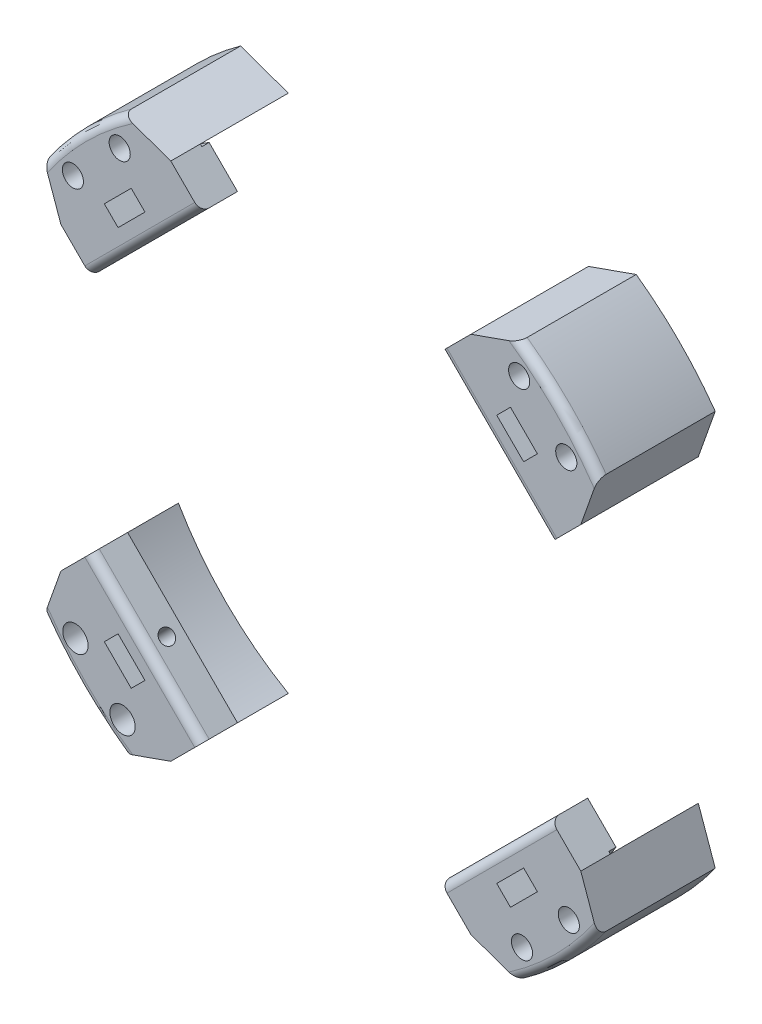
from build123d import *

# Parameters (mm, degrees)
SKETCH5_R             = 1.7
BOSS_EXTRUDE3_DEPTH   = 20.8
BOSS_EXTRUDE3_2_DEPTH = 20.8
BOSS_EXTRUDE3_3_DEPTH = 20.8
BOSS_EXTRUDE3_4_DEPTH = 20.8
SKETCH6_R             = 2.5
CUT_EXTRUDE3_DEPTH    = 15.8
SKETCH8_R             = 2.5
BOSS_EXTRUDE4_DEPTH   = 7
CUT_EXTRUDE4_DEPTH    = 7
SKETCH10_R            = 1.7
CUT_EXTRUDE5_DEPTH    = 16
BOSS_EXTRUDE5_DEPTH   = 1.7
SKETCH14_R            = 1.7
CUT_EXTRUDE6_DEPTH    = 15.361115509
SKETCH15_R            = 1.7
CUT_EXTRUDE7_DEPTH    = 15.361115509
SKETCH16_R            = 1.7
CUT_EXTRUDE8_DEPTH    = 15.361115509
FILLET5_R             = 2
FILLET6_R             = 2
FILLET7_R             = 2
FILLET8_R             = 2
FILLET9_R             = 2
FILLET10_R            = 2
FILLET11_R            = 2
FILLET12_R            = 2
SKETCH17_R            = 3
CUT_EXTRUDE9_DEPTH    = 22.8


with BuildPart() as part:
    # Sketch5 → Boss-Extrude3 (new body)
    with BuildSketch(Plane.XY):
        with BuildLine():
            Line((-45.996091263, 46.802906206), (-41.991324477, 35.493901083))
            ThreePointArc((-41.991324477, 35.493901083), (-30.704574922, 50.204588007), (-15.993885056, 61.491333728))
            Line((-15.993885056, 61.491333728), (-27.302906206, 65.496091263))
            ThreePointArc((-27.302906206, 65.496091263), (-37.422095886, 56.922095886), (-45.996091263, 46.802906206))
        make_face()
        with Locations(Location((-39.158598122, 46.910337234, 0), (0, 0, 90))):
            Circle(SKETCH5_R, mode=Mode.SUBTRACT)
        with Locations(Location((-28.083608747, 58.055274509, 0), (0, 0, 90))):
            Circle(SKETCH5_R, mode=Mode.SUBTRACT)
    extrude(amount=BOSS_EXTRUDE3_DEPTH)


with BuildPart() as body_2:
    # Sketch5 → Boss-Extrude3 2 (new body)
    with BuildSketch(Plane.XY):
        with BuildLine():
            Line((66.302906206, 65.496091263), (54.993901083, 61.491324477))
            ThreePointArc((54.993901083, 61.491324477), (69.704588007, 50.204574922), (80.991333728, 35.493885056))
            Line((80.991333728, 35.493885056), (84.996091262, 46.802906206))
            ThreePointArc((84.996091262, 46.802906206), (76.422095886, 56.922095886), (66.302906206, 65.496091263))
        make_face()
        with Locations(Location((66.410337234, 58.658598122, 0), (0, 0, 90))):
            Circle(SKETCH5_R, mode=Mode.SUBTRACT)
        with Locations(Location((77.555274509, 47.583608747, 0), (0, 0, 90))):
            Circle(SKETCH5_R, mode=Mode.SUBTRACT)
    extrude(amount=BOSS_EXTRUDE3_2_DEPTH)


with BuildPart() as body_3:
    # Sketch5 → Boss-Extrude3 3 (new body)
    with BuildSketch(Plane.XY):
        with BuildLine():
            Line((84.996091263, -46.802906206), (80.991324477, -35.493901083))
            ThreePointArc((80.991324477, -35.493901083), (69.704574922, -50.204588007), (54.993885056, -61.491333728))
            Line((54.993885056, -61.491333728), (66.302906206, -65.496091262))
            ThreePointArc((66.302906206, -65.496091262), (76.422095886, -56.922095885), (84.996091263, -46.802906206))
        make_face()
        with Locations(Location((78.158598122, -46.910337234, 0), (0, 0, 90))):
            Circle(SKETCH5_R, mode=Mode.SUBTRACT)
        with Locations(Location((67.083608747, -58.055274509, 0), (0, 0, 90))):
            Circle(SKETCH5_R, mode=Mode.SUBTRACT)
    extrude(amount=BOSS_EXTRUDE3_3_DEPTH)


with BuildPart() as body_4:
    # Sketch5 → Boss-Extrude3 4 (new body)
    with BuildSketch(Plane.XY):
        with BuildLine():
            Line((-27.302906206, -65.496091262), (-15.993901083, -61.491324477))
            ThreePointArc((-15.993901083, -61.491324477), (-30.704588007, -50.204574922), (-41.991333728, -35.493885056))
            Line((-41.991333728, -35.493885056), (-45.996091262, -46.802906206))
            ThreePointArc((-45.996091262, -46.802906206), (-37.422095886, -56.922095886), (-27.302906206, -65.496091262))
        make_face()
        with Locations(Location((-27.410337234, -58.658598122, 0), (0, 0, 90))):
            Circle(SKETCH5_R, mode=Mode.SUBTRACT)
        with Locations(Location((-38.555274509, -47.583608747, 0), (0, 0, 90))):
            Circle(SKETCH5_R, mode=Mode.SUBTRACT)
    extrude(amount=BOSS_EXTRUDE3_4_DEPTH)


with BuildPart() as cut_extrude3_tool:
    # Sketch6 → Cut-Extrude3 (new body)
    with BuildSketch(Plane.XY.offset(20.8)):
        with Locations((-38.555274509, -47.583608747)):
            Circle(SKETCH6_R)
        with Locations((-27.410337234, -58.658598122)):
            Circle(SKETCH6_R)
        with Locations((-28.083608747, 58.055274509)):
            Circle(SKETCH6_R)
        with Locations((-39.158598122, 46.910337234)):
            Circle(SKETCH6_R)
        with Locations((77.555274509, 47.583608747)):
            Circle(SKETCH6_R)
        with Locations((66.410337234, 58.658598122)):
            Circle(SKETCH6_R)
        with Locations((67.083608747, -58.055274509)):
            Circle(SKETCH6_R)
        with Locations((78.158598122, -46.910337234)):
            Circle(SKETCH6_R)
    extrude(amount=-CUT_EXTRUDE3_DEPTH)


with BuildPart() as part_1:
    add(part.part)

    # Cut-Extrude3: cut by cut_extrude3_tool
    add(cut_extrude3_tool.part, mode=Mode.SUBTRACT)



with BuildPart() as body_2_1:
    add(body_2.part)

    # Cut-Extrude3: cut by cut_extrude3_tool
    add(cut_extrude3_tool.part, mode=Mode.SUBTRACT)


with BuildPart() as body_3_1:
    add(body_3.part)

    # Cut-Extrude3: cut by cut_extrude3_tool
    add(cut_extrude3_tool.part, mode=Mode.SUBTRACT)


with BuildPart() as body_4_1:
    add(body_4.part)

    # Cut-Extrude3: cut by cut_extrude3_tool
    add(cut_extrude3_tool.part, mode=Mode.SUBTRACT)


with BuildPart() as part_2:
    add(part_1.part)

    add(body_2_1.part)  # Boss-Extrude4 merges body 2

    add(body_3_1.part)  # Boss-Extrude4 merges body 3

    add(body_4_1.part)  # Boss-Extrude4 merges body 4
    # Sketch8 → Boss-Extrude4 (add)
    # profile 1 of 4: a face of its own
    with BuildSketch(Plane.XY.offset(20.8)):
        with BuildLine():
            Line((80.991324477, -35.493901083), (84.996091263, -46.802906206))
            ThreePointArc((84.996091263, -46.802906206), (76.422095886, -56.922095885), (66.302906206, -65.496091262))
            Line((66.302906206, -65.496091262), (54.993885056, -61.491333728))
            Line((54.993885056, -61.491333728), (47.922817244, -54.420265916))
            Line((47.922817244, -54.420265916), (73.920253277, -28.422829883))
            Line((73.920253277, -28.422829883), (80.991324477, -35.493901083))
        make_face()
        with Locations((67.083608747, -58.055274509)):
            Circle(SKETCH8_R, mode=Mode.SUBTRACT)
        with Locations((78.158598122, -46.910337234)):
            Circle(SKETCH8_R, mode=Mode.SUBTRACT)
    # profile 2 of 4: a face of its own
    with BuildSketch(Plane.XY.offset(20.8)):
        with BuildLine():
            Line((-15.993901083, -61.491324477), (-27.302906206, -65.496091262))
            ThreePointArc((-27.302906206, -65.496091262), (-37.422095886, -56.922095886), (-45.996091262, -46.802906206))
            Line((-45.996091262, -46.802906206), (-41.991333728, -35.493885056))
            Line((-41.991333728, -35.493885056), (-34.920265916, -28.422817244))
            Line((-34.920265916, -28.422817244), (-8.922829883, -54.420253277))
            Line((-8.922829883, -54.420253277), (-15.993901083, -61.491324477))
        make_face()
        with Locations((-38.555274509, -47.583608747)):
            Circle(SKETCH8_R, mode=Mode.SUBTRACT)
        with Locations((-27.410337234, -58.658598122)):
            Circle(SKETCH8_R, mode=Mode.SUBTRACT)
    # profile 3 of 4: a face of its own
    with BuildSketch(Plane.XY.offset(20.8)):
        with BuildLine():
            Line((-41.991324477, 35.493901083), (-45.996091263, 46.802906206))
            ThreePointArc((-45.996091263, 46.802906206), (-37.422095886, 56.922095886), (-27.302906206, 65.496091263))
            Line((-27.302906206, 65.496091263), (-15.993885056, 61.491333728))
            Line((-15.993885056, 61.491333728), (-8.922817244, 54.420265916))
            Line((-8.922817244, 54.420265916), (-34.920253277, 28.422829883))
            Line((-34.920253277, 28.422829883), (-41.991324477, 35.493901083))
        make_face()
        with Locations((-28.083608747, 58.055274509)):
            Circle(SKETCH8_R, mode=Mode.SUBTRACT)
        with Locations((-39.158598122, 46.910337234)):
            Circle(SKETCH8_R, mode=Mode.SUBTRACT)
    # profile 4 of 4: a face of its own
    with BuildSketch(Plane.XY.offset(20.8)):
        with BuildLine():
            Line((54.993901083, 61.491324477), (66.302906206, 65.496091263))
            ThreePointArc((66.302906206, 65.496091263), (76.422095886, 56.922095886), (84.996091262, 46.802906206))
            Line((84.996091262, 46.802906206), (80.991333728, 35.493885056))
            Line((80.991333728, 35.493885056), (73.920265916, 28.422817244))
            Line((73.920265916, 28.422817244), (47.922829883, 54.420253277))
            Line((47.922829883, 54.420253277), (54.993901083, 61.491324477))
        make_face()
        with Locations((77.555274509, 47.583608747)):
            Circle(SKETCH8_R, mode=Mode.SUBTRACT)
        with Locations((66.410337234, 58.658598122)):
            Circle(SKETCH8_R, mode=Mode.SUBTRACT)
    extrude(amount=BOSS_EXTRUDE4_DEPTH)

    # Sketch9 → Cut-Extrude4 (cut)
    with BuildSketch(Plane.XY.offset(27.8)):
        Polygon((-23.732517405, 49.596491074), (-22.106171808, 47.970145478), (-25.288152323, 44.788164962), (-28.470132839, 41.606184447), (-30.096478435, 43.232530044), (-31.722824032, 44.85887564), (-25.358863001, 51.222836671), align=None)
        Polygon((-30.096491074, -43.232517405), (-28.470145478, -41.606171808), (-25.288164962, -44.788152323), (-22.106184447, -47.970132839), (-23.732530044, -49.596478435), (-25.35887564, -51.222824032), (-31.722836671, -44.858863001), align=None)
        Polygon((69.096491074, 43.232517405), (67.470145478, 41.606171808), (64.288164962, 44.788152323), (61.106184447, 47.970132839), (62.732530044, 49.596478435), (64.35887564, 51.222824032), (70.722836671, 44.858863002), align=None)
        Polygon((62.732517405, -49.596491074), (61.106171808, -47.970145478), (64.288152323, -44.788164962), (67.470132839, -41.606184447), (69.096478435, -43.232530044), (70.722824032, -44.85887564), (64.358863001, -51.222836671), align=None)
    extrude(amount=-CUT_EXTRUDE4_DEPTH, mode=Mode.SUBTRACT)

    # Sketch10 → Cut-Extrude5 (cut)
    with BuildSketch(Plane(origin=(-31.67154158, 31.67154158, 0), x_dir=(0, 0, -1), z_dir=(0.7071067811865427, -0.7071067811865525, 0))):
        with Locations(Location((-22.8, 13.78859117, 0), (0, 0, 90))):
            Circle(SKETCH10_R)
    extrude(amount=-CUT_EXTRUDE5_DEPTH, mode=Mode.SUBTRACT)

    # Sketch12 → Boss-Extrude5 (add)
    # profile 1 of 4: a face of its own
    with BuildSketch(Plane(origin=(0, 0, 20.8), x_dir=(-1, 0, 0), z_dir=(0, 0, -1))):
        with BuildLine():
            Line((15.627772636, -61.12519603), (8.922829883, -54.420253277))
            Line((8.922829883, -54.420253277), (34.920265916, -28.422817244))
            Line((34.920265916, -28.422817244), (41.625205255, -35.127756583))
            ThreePointArc((41.625205255, -35.127756583), (30.35103462, -49.851021528), (15.627772636, -61.12519603))
        make_face()
        Polygon((31.722836671, -44.858863001), (28.470145478, -41.606171808), (22.106184447, -47.970132839), (25.35887564, -51.222824032), align=None, mode=Mode.SUBTRACT)
    # profile 2 of 4: a face of its own
    with BuildSketch(Plane(origin=(0, 0, 20.8), x_dir=(-1, 0, 0), z_dir=(0, 0, -1))):
        with BuildLine():
            Line((-80.62519603, -35.127772636), (-73.920253277, -28.422829883))
            Line((-73.920253277, -28.422829883), (-47.922817244, -54.420265916))
            Line((-47.922817244, -54.420265916), (-54.627756583, -61.125205255))
            ThreePointArc((-54.627756583, -61.125205255), (-69.351021528, -49.85103462), (-80.62519603, -35.127772636))
        make_face()
        Polygon((-64.358863001, -51.222836671), (-61.106171808, -47.970145478), (-67.470132839, -41.606184447), (-70.722824032, -44.85887564), align=None, mode=Mode.SUBTRACT)
    # profile 3 of 4: a face of its own
    with BuildSketch(Plane(origin=(0, 0, 20.8), x_dir=(-1, 0, 0), z_dir=(0, 0, -1))):
        with BuildLine():
            Line((-54.627772636, 61.12519603), (-47.922829883, 54.420253277))
            Line((-47.922829883, 54.420253277), (-73.920265916, 28.422817244))
            Line((-73.920265916, 28.422817244), (-80.625205255, 35.127756583))
            ThreePointArc((-80.625205255, 35.127756583), (-69.35103462, 49.851021528), (-54.627772636, 61.12519603))
        make_face()
        Polygon((-70.722836671, 44.858863002), (-67.470145478, 41.606171808), (-61.106184447, 47.970132839), (-64.35887564, 51.222824032), align=None, mode=Mode.SUBTRACT)
    # profile 4 of 4: a face of its own
    with BuildSketch(Plane(origin=(0, 0, 20.8), x_dir=(-1, 0, 0), z_dir=(0, 0, -1))):
        with BuildLine():
            Line((41.62519603, 35.127772636), (34.920253277, 28.422829883))
            Line((34.920253277, 28.422829883), (8.922817244, 54.420265916))
            Line((8.922817244, 54.420265916), (15.627756583, 61.125205255))
            ThreePointArc((15.627756583, 61.125205255), (30.351021528, 49.85103462), (41.62519603, 35.127772636))
        make_face()
        Polygon((25.358863001, 51.222836671), (22.106171808, 47.970145478), (28.470132839, 41.606184447), (31.722824032, 44.85887564), align=None, mode=Mode.SUBTRACT)
    extrude(amount=BOSS_EXTRUDE5_DEPTH)

    # Sketch14 → Cut-Extrude6 (cut)
    with BuildSketch(Plane(origin=(-31.67154158, -31.67154158, 0), x_dir=(0, 0, -1), z_dir=(0.70710678118655, 0.707106781186545, 0))):
        with Locations(Location((-22.8, -13.788573296, 0), (0, 0, 270))):
            Circle(SKETCH14_R)
    extrude(amount=-CUT_EXTRUDE6_DEPTH, mode=Mode.SUBTRACT)

    # Sketch15 → Cut-Extrude7 (cut)
    with BuildSketch(Plane(origin=(51.17154158, -51.17154158, 0), x_dir=(0, 0, 1), z_dir=(-0.7071067811865477, 0.7071067811865475, 0))):
        with Locations(Location((22.8, 13.788573296, 0), (0, 0, 270))):
            Circle(SKETCH15_R)
    extrude(amount=-CUT_EXTRUDE7_DEPTH, mode=Mode.SUBTRACT)

    # Sketch16 → Cut-Extrude8 (cut)
    with BuildSketch(Plane(origin=(51.17154158, 51.17154158, 0), x_dir=(0, 0, 1), z_dir=(-0.7071067811865551, -0.7071067811865399, 0))):
        with Locations(Location((22.8, -13.78859117, 0), (0, 0, 90))):
            Circle(SKETCH16_R)
    extrude(amount=-CUT_EXTRUDE8_DEPTH, mode=Mode.SUBTRACT)

    # Fillet5
    fillet5_edges = [part_2.edges().sort_by_distance(p)[0] for p in [
        (-37.422095886, 56.922095886, 27.8),
    ]]
    fillet(fillet5_edges, radius=FILLET5_R)

    # Fillet6
    fillet6_edges = [part_2.edges().sort_by_distance(p)[0] for p in [
        (-37.422095886, -56.922095886, 27.8),
    ]]
    fillet(fillet6_edges, radius=FILLET6_R)

    # Fillet7
    fillet7_edges = [part_2.edges().sort_by_distance(p)[0] for p in [
        (76.422095886, -56.922095885, 27.8),
    ]]
    fillet(fillet7_edges, radius=FILLET7_R)

    # Fillet8
    fillet8_edges = [part_2.edges().sort_by_distance(p)[0] for p in [
        (76.422095886, 56.922095886, 27.8),
    ]]
    fillet(fillet8_edges, radius=FILLET8_R)

    # Fillet9
    fillet9_edges = [part_2.edges().sort_by_distance(p)[0] for p in [
        (-21.921535261, 41.4215479, 27.8),
    ]]
    fillet(fillet9_edges, radius=FILLET9_R)

    # Fillet10
    fillet10_edges = [part_2.edges().sort_by_distance(p)[0] for p in [
        (60.9215479, 41.421535261, 27.8),
    ]]
    fillet(fillet10_edges, radius=FILLET10_R)

    # Fillet11
    fillet11_edges = [part_2.edges().sort_by_distance(p)[0] for p in [
        (60.921535261, -41.421547899, 27.8),
    ]]
    fillet(fillet11_edges, radius=FILLET11_R)

    # Fillet12
    fillet12_edges = [part_2.edges().sort_by_distance(p)[0] for p in [
        (-21.9215479, -41.421535261, 27.8),
    ]]
    fillet(fillet12_edges, radius=FILLET12_R)

    # Sketch17 → Cut-Extrude9 (cut)
    with BuildSketch(Plane.XY.offset(27.8)):
        with Locations((-38.555274509, -47.583608747)):
            Circle(SKETCH17_R)
        with Locations((-27.410337234, -58.658598122)):
            Circle(SKETCH17_R)
    extrude(amount=-CUT_EXTRUDE9_DEPTH, mode=Mode.SUBTRACT)


solid = part_2.part
